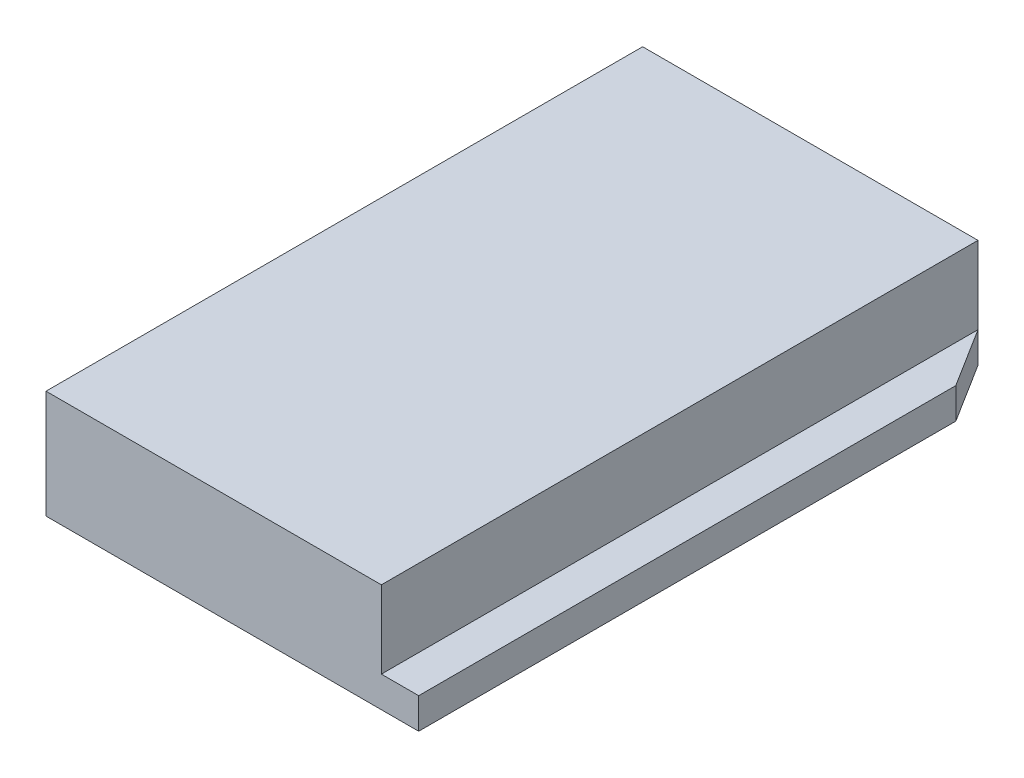
from build123d import *

# Parameters (mm, degrees)
SKETCH1_W           = 7.874
SKETCH1_H           = 14.0081
BOSS_EXTRUDE1_DEPTH = 2.54
SKETCH2_W           = 1.101725
SKETCH2_H           = 1.0033
CUT_EXTRUDE1_DEPTH  = 8.636
BOSS_EXTRUDE3_DEPTH = 0.7239


with BuildPart() as part:
    # Sketch1 → Boss-Extrude1 (new body)
    with BuildSketch(Plane(origin=(0, 0, 0), x_dir=(1, 0, 0), z_dir=(0, 1, 0))):
        with Locations((3.937, 7.00405)):
            Rectangle(SKETCH1_W, SKETCH1_H)
    extrude(amount=BOSS_EXTRUDE1_DEPTH)

    # Sketch2 → Cut-Extrude1 (cut)
    with BuildSketch(Plane(origin=(0, 0, -14.0081), x_dir=(-1, 0, 0), z_dir=(0, 0, -1))):
        with Locations((-6.4976375, 1.36525)):
            Rectangle(SKETCH2_W, SKETCH2_H)
        with Locations((-3.971925, 1.36525)):
            Rectangle(SKETCH2_W, SKETCH2_H)
        with Locations((-1.4462125, 1.36525)):
            Rectangle(SKETCH2_W, SKETCH2_H)
    extrude(amount=-CUT_EXTRUDE1_DEPTH, mode=Mode.SUBTRACT)

    # Sketch5 → Boss-Extrude3 (add)
    with BuildSketch(Plane.XZ):
        Polygon((7.874, -14.0081), (7.874, 0), (8.7503, 0), (8.7503, -12.6111), align=None)
    extrude(amount=-BOSS_EXTRUDE3_DEPTH)


solid = part.part
